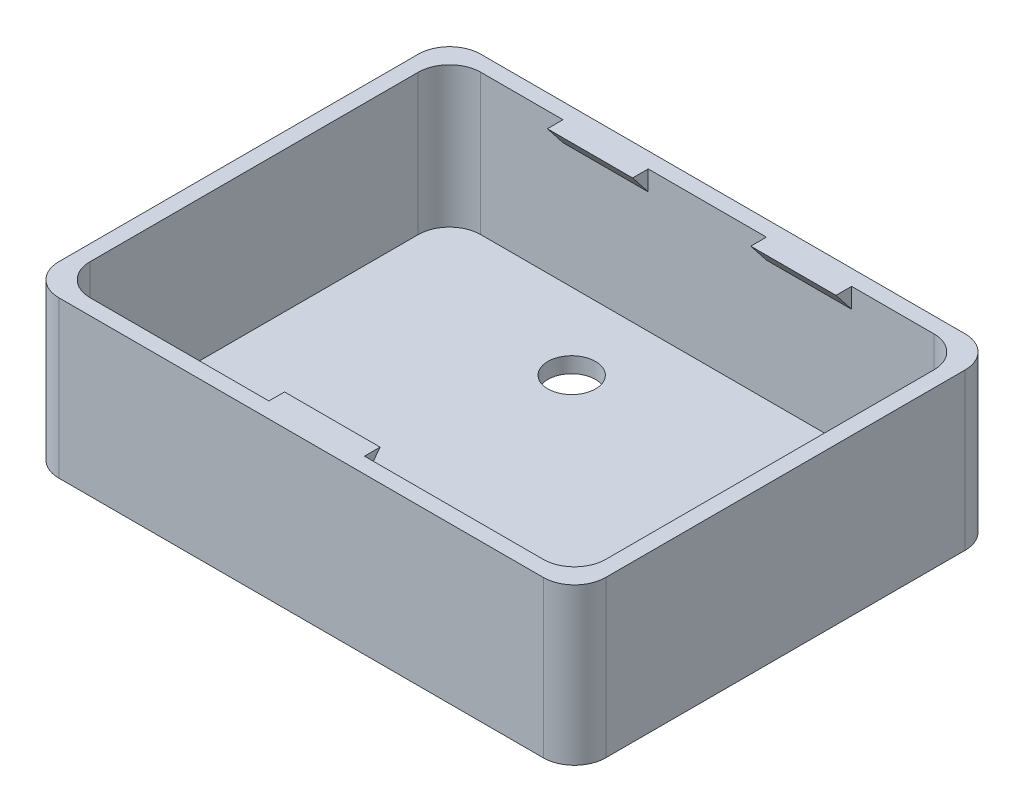
from build123d import *

# Parameters (mm, degrees)
SKETCH1_W           = 35
SKETCH1_H           = 27
BOSS_EXTRUDE1_DEPTH = 10
SKETCH2_W           = 33
SKETCH2_H           = 25
CUT_EXTRUDE1_DEPTH  = 9
SKETCH3_W           = 5.453863721
SKETCH3_H           = 1.273193124
BOSS_EXTRUDE2_DEPTH = 1
SKETCH4_W           = 6.116939674
SKETCH4_H           = 1.326628088
BOSS_EXTRUDE5_DEPTH = 1
CUT_EXTRUDE2_DEPTH  = 8
CUT_EXTRUDE5_DEPTH  = 8
CUT_EXTRUDE6_DEPTH  = 8
FILLET1_R           = 2
FILLET2_R           = 2
SKETCH8_R           = 1.524
CUT_EXTRUDE7_DEPTH  = 8


with BuildPart() as part:
    # Sketch1 → Boss-Extrude1 (new body)
    with BuildSketch(Plane(origin=(0, 0, 0), x_dir=(1, 0, 0), z_dir=(0, 1, 0))):
        Rectangle(SKETCH1_W, SKETCH1_H)
    extrude(amount=BOSS_EXTRUDE1_DEPTH)

    # Sketch2 → Cut-Extrude1 (cut)
    with BuildSketch(Plane(origin=(0, 10, 0), x_dir=(1, 0, 0), z_dir=(0, 1, 0))):
        Rectangle(SKETCH2_W, SKETCH2_H)
    extrude(amount=-CUT_EXTRUDE1_DEPTH, mode=Mode.SUBTRACT)

    # Sketch3 → Boss-Extrude2 (add)
    with BuildSketch(Plane.XY.offset(-12.5)):
        with Locations((6.508277375, 9.363403438)):
            Rectangle(SKETCH3_W, SKETCH3_H)
        with Locations((-6.508277375, 9.363403438)):
            Rectangle(SKETCH3_W, SKETCH3_H)
    extrude(amount=BOSS_EXTRUDE2_DEPTH)

    # Sketch4 → Boss-Extrude5 (add)
    with BuildSketch(Plane(origin=(0, 0, 12.5), x_dir=(-1, 0, 0), z_dir=(0, 0, -1))):
        with Locations((0, 9.336685956)):
            Rectangle(SKETCH4_W, SKETCH4_H)
    extrude(amount=BOSS_EXTRUDE5_DEPTH)

    # Sketch5 → Cut-Extrude2 (cut)
    with BuildSketch(Plane(origin=(3.058469837, 0, 0), x_dir=(0, 0, -1), z_dir=(1, 0, 0))):
        Polygon((-12.5, 8.673371912), (-11.5, 10), (-11.5, 8.673371912), align=None)
    extrude(amount=-CUT_EXTRUDE2_DEPTH, mode=Mode.SUBTRACT)

    # Sketch6 → Cut-Extrude5 (cut)
    with BuildSketch(Plane(origin=(9.235209235, 0, 0), x_dir=(0, 0, -1), z_dir=(1, 0, 0))):
        Polygon((11.5, 10), (12.5, 8.726806876), (11.5, 8.726806876), align=None)
    extrude(amount=-CUT_EXTRUDE5_DEPTH, mode=Mode.SUBTRACT)

    # Sketch7 → Cut-Extrude6 (cut)
    with BuildSketch(Plane(origin=(-3.781345514, 0, 0), x_dir=(0, 0, -1), z_dir=(1, 0, 0))):
        Polygon((11.5, 10), (12.5, 8.726806876), (11.5, 8.726806876), align=None)
    extrude(amount=-CUT_EXTRUDE6_DEPTH, mode=Mode.SUBTRACT)

    # Fillet1
    fillet1_edges = [part.edges().sort_by_distance(p)[0] for p in [
        (-17.5, 5, -13.5),
        (17.5, 5, -13.5),
        (17.5, 5, 13.5),
        (-17.5, 5, 13.5),
    ]]
    fillet(fillet1_edges, radius=FILLET1_R)

    # Fillet2
    fillet2_edges = [part.edges().sort_by_distance(p)[0] for p in [
        (-16.5, 5.5, 12.5),
        (-16.5, 5.5, -12.5),
        (16.5, 5.5, -12.5),
        (16.5, 5.5, 12.5),
    ]]
    fillet(fillet2_edges, radius=FILLET2_R)

    # Sketch8 → Cut-Extrude7 (cut)
    with BuildSketch(Plane(origin=(0, 1, 0), x_dir=(1, 0, 0), z_dir=(0, 1, 0))):
        with Locations(Location((-3.8, -7.62, 0), (0, 0, 270))):
            Circle(SKETCH8_R)
        with Locations(Location((-3.8, 7.62, 0), (0, 0, 270))):
            Circle(SKETCH8_R)
    extrude(amount=-CUT_EXTRUDE7_DEPTH, mode=Mode.SUBTRACT)


solid = part.part
